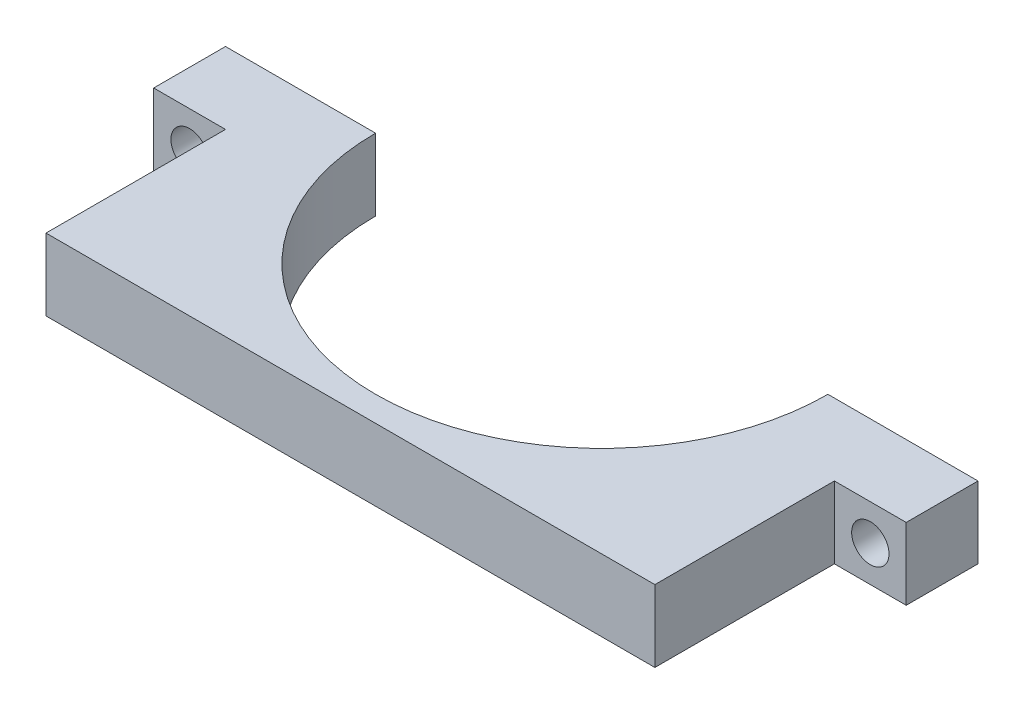
from build123d import *

# Parameters (mm, degrees)
BOSS_EXTRUDE1_DEPTH = 12.7
CUT_EXTRUDE1_REACH  = 81.372
SKETCH2_R           = 3.302


with BuildPart() as part:
    # Sketch1 → Boss-Extrude1 (new body)
    with BuildSketch(Plane(origin=(0, 0, 0), x_dir=(1, 0, 0), z_dir=(0, 1, 0))):
        with BuildLine():
            Line((-34.92484398, 0), (-61.46784398, 0))
            Line((-61.46784398, 0), (-61.46784398, -12.7))
            Line((-61.46784398, -12.7), (-48.76784398, -12.7))
            Line((-48.76784398, -12.7), (-48.76784398, -44.45))
            Line((-48.76784398, -44.45), (58.92815602, -44.45))
            Line((58.92815602, -44.45), (58.92815602, -12.7))
            Line((58.92815602, -12.7), (71.62815602, -12.7))
            Line((71.62815602, -12.7), (71.62815602, 0))
            Line((71.62815602, 0), (45.08515602, 0))
            ThreePointArc((45.08515602, 0), (5.08015602, -40.005), (-34.92484398, 0))
        make_face()
    extrude(amount=BOSS_EXTRUDE1_DEPTH)

    # Sketch2 → Cut-Extrude1 (cut, up to next)
    with BuildSketch(Plane.XY.offset(12.7), mode=Mode.PRIVATE) as cut_extrude1_sk1:
        with Locations((65.27815602, 6.35)):
            Circle(SKETCH2_R)
    cut_extrude1_tool1 = extrude(cut_extrude1_sk1.sketch, amount=-CUT_EXTRUDE1_REACH, mode=Mode.PRIVATE) & part.part
    # Sketch2 → Cut-Extrude1 (cut, up to next)
    with BuildSketch(Plane.XY.offset(12.7), mode=Mode.PRIVATE) as cut_extrude1_sk2:
        with Locations((-55.11784398, 6.35)):
            Circle(SKETCH2_R)
    cut_extrude1_tool2 = extrude(cut_extrude1_sk2.sketch, amount=-CUT_EXTRUDE1_REACH, mode=Mode.PRIVATE) & part.part
    add(cut_extrude1_tool1.solids().sort_by_distance((65.278156, 6.35, 12.7))[0], mode=Mode.SUBTRACT)
    add(cut_extrude1_tool2.solids().sort_by_distance((-55.117844, 6.35, 12.7))[0], mode=Mode.SUBTRACT)


solid = part.part
